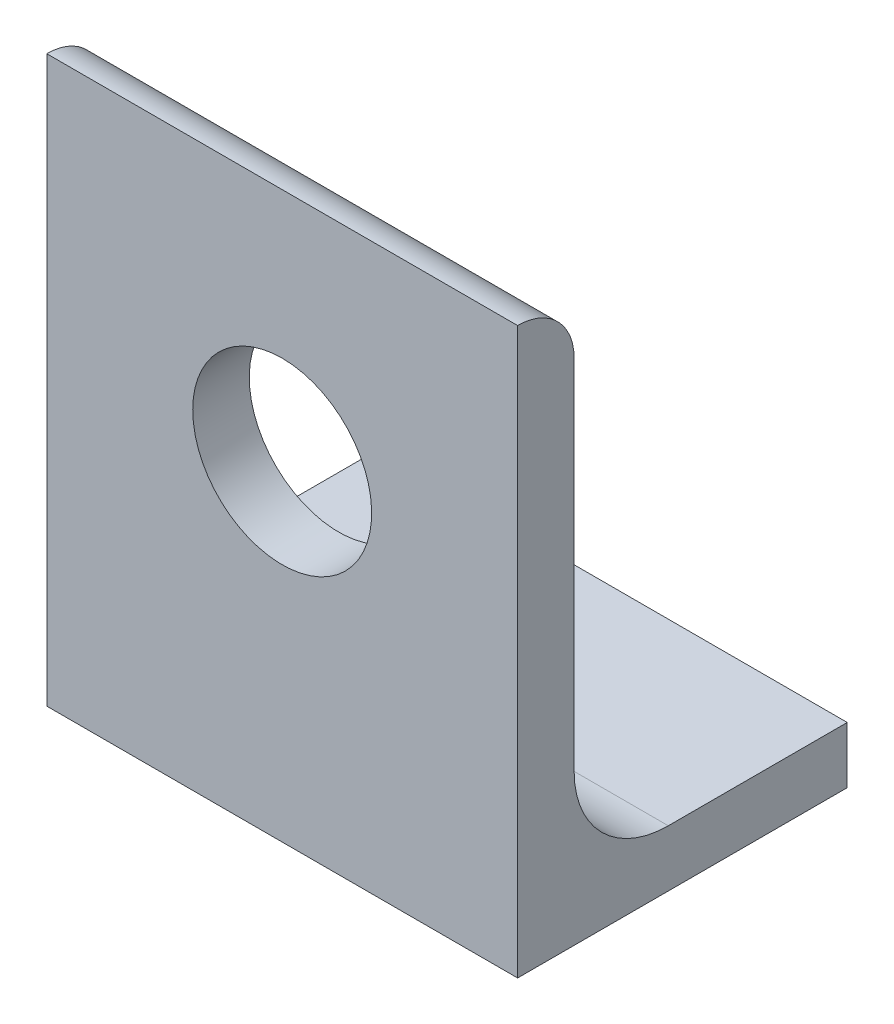
from build123d import *

# Parameters (mm, degrees)
L_ANGLE_EQUAL_30X30X3_2_DEPTH  = 25
F_9_5_9_5_DIAMETER_HOLE1_D     = 9.5
F_9_5_9_5_DIAMETER_HOLE1_DEPTH = 18
F_9_5_9_5_DIAMETER_HOLE1_TIP   = 2.85408794
CUT_EXTRUDE1_REACH             = 51.244
SKETCH15_W                     = 25
SKETCH15_H                     = 12.5


with BuildPart() as part:
    # Sketch19 → L angle (equal) 30X30X3(2) (new body)
    with BuildSketch(Plane(origin=(-25, 0, 0), x_dir=(0, 0, -1), z_dir=(1, 0, 0))):
        with BuildLine():
            Line((0, 30), (0, 0))
            Line((0, 0), (30, 0))
            ThreePointArc((30, 0), (29.121320344, 2.121320344), (27, 3))
            Line((27, 3), (8, 3))
            ThreePointArc((8, 3), (4.464466094, 4.464466094), (3, 8))
            Line((3, 8), (3, 27))
            ThreePointArc((3, 27), (2.121320344, 29.121320344), (0, 30))
        make_face()
    extrude(amount=L_ANGLE_EQUAL_30X30X3_2_DEPTH)

    # Ø9.5 (9.5) Diameter Hole1
    with Locations(Plane(origin=(0, 0, -3), x_dir=(-1, 0, 0), z_dir=(0, 0, -1))):
        with Locations((12.5, 17.5)):
            Hole(F_9_5_9_5_DIAMETER_HOLE1_D / 2, depth=F_9_5_9_5_DIAMETER_HOLE1_DEPTH)
            with Locations((0, 0, -(F_9_5_9_5_DIAMETER_HOLE1_DEPTH + F_9_5_9_5_DIAMETER_HOLE1_TIP / 2))):  # 118° drill point
                Cone(0, F_9_5_9_5_DIAMETER_HOLE1_D / 2, F_9_5_9_5_DIAMETER_HOLE1_TIP, mode=Mode.SUBTRACT)

    # Sketch15 → Cut-Extrude1 (cut, up to next)
    with BuildSketch(Plane.XZ, mode=Mode.PRIVATE) as cut_extrude1_sk1:
        with Locations((-12.5, -23.75)):
            Rectangle(SKETCH15_W, SKETCH15_H)
    cut_extrude1_tool1 = extrude(cut_extrude1_sk1.sketch, amount=-CUT_EXTRUDE1_REACH, mode=Mode.PRIVATE) & part.part
    add(cut_extrude1_tool1.solids().sort_by_distance((-12.5, 0, -23.75))[0], mode=Mode.SUBTRACT)


solid = part.part
